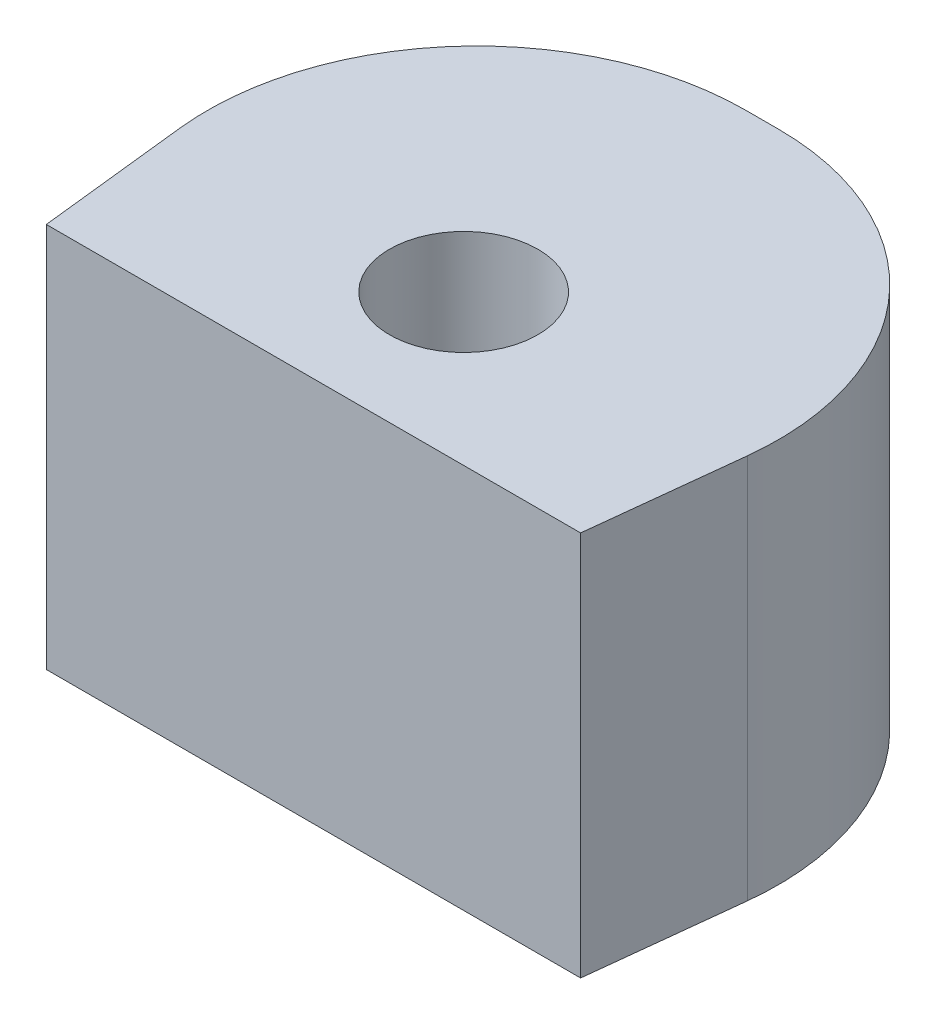
from build123d import *

# Parameters (mm, degrees)
SKETCH1_R               = 1.984375
BOSS_EXTRUDE1_DEPTH     = 169.87266
SKETCH2_W               = 35.763807095
SKETCH2_H               = 22.705005105
CUT_EXTRUDE1_DEPTH      = 23.05812
CUT_EXTRUDE2_START      = -169.87266
SKETCH2_2_W             = 35.763807095
SKETCH2_2_H             = 22.705005105
CUT_EXTRUDE2_DEPTH      = 23.05812
FILLET1_R               = 7.62
CUT_EXTRUDE3_DEPTH      = 198.390942599
CUT_EXTRUDE3_DEPTH_BACK = 198.390942599
SKETCH6_R               = 2.1
CUT_EXTRUDE4_DEPTH      = 198.390942599
CUT_EXTRUDE4_DEPTH_BACK = 198.390942599
SKETCH7_W               = 96.266326783
SKETCH7_H               = 154.195082356
SKETCH7_H_2             = 4.765737644
CUT_EXTRUDE5_DEPTH      = 101.887240685
CUT_EXTRUDE5_DEPTH_BACK = 101.887240685
SKETCH8_W               = 55.334278697
SKETCH8_H               = 64.985105724


with BuildPart() as part:
    # Sketch1 → Boss-Extrude1 (new body)
    with BuildSketch(Plane(origin=(0, 0, 0), x_dir=(1, 0, 0), z_dir=(0, 1, 0))):
        with BuildLine():
            Line((-9.955287346, -3.607451573), (-6.769721368, -3.607451573))
            Line((-6.769721368, -3.607451573), (8.985913589, -3.607451573))
            Line((8.985913589, -3.607451573), (12.171479568, -3.607451573))
            add(Edge.make_bspline(
                [(10.60289965, -20.752451573), (11.099968974, -15.730201571), (11.630563617, -10.016003166), (12.113997871, -4.296816952), (12.171479568, -3.607451573)],
                knots=[0.384969626, 0.384969626, 0.384969626, 0.384969626, 0.458108671, 0.468131593, 0.468131593, 0.468131593, 0.468131593], degree=3))
            add(Edge.make_bspline(
                [(1.108096111, -99.873778356), (4.527344744, -73.531764163), (7.9865599, -47.187219652), (10.60289965, -20.752451573)],
                knots=[0, 0, 0, 0, 0.384969626, 0.384969626, 0.384969626, 0.384969626], degree=3))
            add(Edge.make_bspline(
                [(1.108096111, -99.873778356), (-2.311152522, -73.531764163), (-5.770367679, -47.187219652), (-8.386707429, -20.752451573)],
                knots=[0, 0, 0, 0, 0.384969626, 0.384969626, 0.384969626, 0.384969626], degree=3))
            add(Edge.make_bspline(
                [(-8.386707429, -20.752451573), (-8.883776753, -15.730201571), (-9.414371396, -10.016003166), (-9.89780565, -4.296816952), (-9.955287346, -3.607451573)],
                knots=[0.384969626, 0.384969626, 0.384969626, 0.384969626, 0.458108671, 0.468131593, 0.468131593, 0.468131593, 0.468131593], degree=3))
        make_face()
        with Locations(Location((1.108108569, -11.326456678, 0), (0, 0, 270))):
            Circle(SKETCH1_R, mode=Mode.SUBTRACT)
    extrude(amount=BOSS_EXTRUDE1_DEPTH)

    # Sketch2 → Cut-Extrude1 (cut)
    with BuildSketch(Plane(origin=(0, 169.87266, 0), x_dir=(1, 0, 0), z_dir=(0, 1, 0))):
        with Locations((7.926616202, -14.959954125)):
            Rectangle(SKETCH2_W, SKETCH2_H)
    extrude(amount=-CUT_EXTRUDE1_DEPTH, mode=Mode.SUBTRACT)

    # Sketch2<2> → Cut-Extrude2 (cut)
    with BuildSketch(Plane(origin=(0, 169.87266, 0), x_dir=(1, 0, 0), z_dir=(0, 1, 0)).offset(CUT_EXTRUDE2_START)):
        with Locations((7.926616202, -14.959954125)):
            Rectangle(SKETCH2_2_W, SKETCH2_2_H)
    extrude(amount=CUT_EXTRUDE2_DEPTH, mode=Mode.SUBTRACT)

    # Fillet1
    fillet1_edges = [part.edges().sort_by_distance(p)[0] for p in [
        (-7.824155374, 11.52906, 26.312456678),
        (10.040347595, 11.52906, 26.312456678),
        (-9.955287346, 84.93633, 3.607451573),
        (12.171479568, 84.93633, 3.607451573),
        (-7.824155374, 158.3436, 26.312456678),
        (10.040347595, 158.3436, 26.312456678),
    ]]
    fillet(fillet1_edges, radius=FILLET1_R)

    # Sketch6 → Cut-Extrude3 (cut, two sides: drawn at the far end of the back side and taken through both)
    with BuildSketch(Plane.XZ.offset(-CUT_EXTRUDE3_DEPTH_BACK)):
        with Locations(Location((1.108096111, 71.933778356, 0), (0, 0, 270))):
            Circle(SKETCH6_R)
        with Locations(Location((1.108096111, 34.760552137, 0), (0, 0, 270))):
            Circle(SKETCH6_R)
    extrude(amount=CUT_EXTRUDE3_DEPTH + CUT_EXTRUDE3_DEPTH_BACK, mode=Mode.SUBTRACT)

    # Sketch7 → Cut-Extrude4 (cut, two sides: drawn at the far end of the back side and taken through both)
    with BuildSketch(Plane(origin=(0, 0, 0), x_dir=(0, 0, -1), z_dir=(1, 0, 0)).offset(-CUT_EXTRUDE4_DEPTH_BACK)):
        with Locations((-51.740614965, 77.097541178)):
            Rectangle(SKETCH7_W, SKETCH7_H)
        with Locations((-51.740614965, 167.489791178)):
            Rectangle(SKETCH7_W, SKETCH7_H_2)
    extrude(amount=CUT_EXTRUDE4_DEPTH + CUT_EXTRUDE4_DEPTH_BACK, mode=Mode.SUBTRACT)

    # Sketch8 → Cut-Extrude5 (cut, two sides: drawn at the far end of the back side and taken through both)
    with BuildSketch(Plane.XZ.offset(-154.195082356).offset(-CUT_EXTRUDE5_DEPTH_BACK)):
        with Locations((-8.071043379, 71.50500954)):
            Rectangle(SKETCH8_W, SKETCH8_H)
    extrude(amount=CUT_EXTRUDE5_DEPTH + CUT_EXTRUDE5_DEPTH_BACK, mode=Mode.SUBTRACT)


solid = part.part
